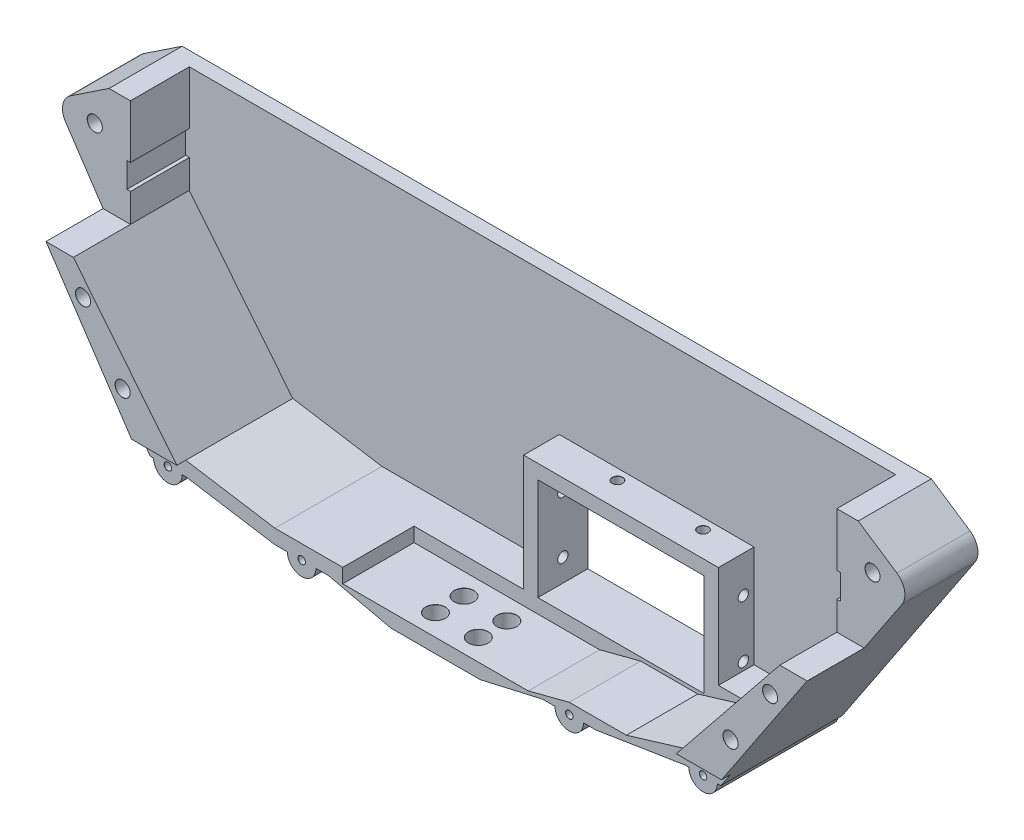
from build123d import *

# Parameters (mm, degrees)
EXTRUDE_1_DEPTH                  = 4
EXTRUDE_2_DEPTH                  = 16.5
SKETCH_4_W                       = 46.6
SKETCH_4_H                       = 28.6
CUT_EXTRUDE_1_DEPTH              = 4
EXTRUDE_3_DEPTH                  = 10
HOLE_WIZARD_M2_5_1_D             = 2.9
HOLE_WIZARD_M2_5_1_CSINK_D       = 2.95
HOLE_WIZARD_M2_5_1_CSINK_ANGLE   = 90
HOLE_WIZARD_M2_5_2_D             = 2.9
HOLE_WIZARD_M2_5_2_CSINK_D       = 2.95
HOLE_WIZARD_M2_5_2_CSINK_ANGLE   = 90
HOLE_WIZARD_M5_1_D               = 4.2
HOLE_WIZARD_M5_1_DEPTH           = 5
HOLE_WIZARD_M5_1_CSINK_D         = 4.25
HOLE_WIZARD_M5_1_CSINK_ANGLE     = 90
HOLE_WIZARD_M5_1_TIP             = 1.2618073
EXTRUDE_4_DEPTH                  = 17
EXTRUDE_START                    = -17
EXTRUDE_5_DEPTH                  = 34
EXTRUDE_6_DEPTH                  = 20
SKETCH_20_W                      = 52
SKETCH_20_H                      = 4
CUT_EXTRUDE_2_DEPTH              = 3
CUT_EXTRUDE_3_DEPTH              = 10
SKETCH_22_R                      = 4
EXTRUDE_7_DEPTH                  = 34
HOLE_WIZARD_M2_5_1_2_D           = 2.05
HOLE_WIZARD_M2_5_1_2_DEPTH       = 10
HOLE_WIZARD_M2_5_1_2_CSINK_D     = 2.1
HOLE_WIZARD_M2_5_1_2_CSINK_ANGLE = 90
HOLE_WIZARD_M2_5_1_2_TIP         = 0.615882135
CUT_EXTRUDE_4_DEPTH              = 20
EXTRUDE_8_DEPTH                  = 32.5
HOLE_WIZARD_M5_2_D               = 4.2
HOLE_WIZARD_M5_2_DEPTH           = 10
HOLE_WIZARD_M5_2_CSINK_D         = 4.25
HOLE_WIZARD_M5_2_CSINK_ANGLE     = 90
HOLE_WIZARD_M5_2_TIP             = 1.2618073
FILLET_1_R                       = 5
HOLE_WIZARD_M5_1_2_D             = 5.5
HOLE_WIZARD_M5_1_2_DEPTH         = 10
HOLE_WIZARD_M5_1_2_CSINK_D       = 5.55
HOLE_WIZARD_M5_1_2_CSINK_ANGLE   = 90
HOLE_WIZARD_M5_1_2_TIP           = 1.652366702


with BuildPart() as part:
    # 草图2 → 凸台-拉伸1 (new body)
    with BuildSketch(Plane.XY):
        Polygon((80, 0), (-80, 0), (-120, 60), (-105, 70), (105, 70), (120, 60), align=None)
    extrude(amount=EXTRUDE_1_DEPTH)

    # 草图3 → 凸台-拉伸2 (add)
    with BuildSketch(Plane.XY.offset(4)):
        Polygon((105, 70), (99, 70), (99, 55), (100, 55), (100, 48), (99, 48), (99, 40), (106.666666667, 40), (120, 60), align=None)
        Polygon((-120, 60), (-105, 70), (-99, 70), (-99, 55), (-100, 55), (-100, 48), (-99, 48), (-99, 40), (-106.666666667, 40), align=None)
    extrude(amount=EXTRUDE_2_DEPTH)

    # 草图4 → 切除-拉伸1 (cut)
    with BuildSketch(Plane.XY.offset(4)):
        with Locations((32, 14.3)):
            Rectangle(SKETCH_4_W, SKETCH_4_H)
    extrude(amount=-CUT_EXTRUDE_1_DEPTH, mode=Mode.SUBTRACT)

    # 草图5 → 凸台-拉伸3 (add)
    with BuildSketch(Plane.XY.offset(4)):
        Polygon((55.3, 28.6), (55.3, 0), (80, 0), (82.666666667, 4), (59.3, 4), (59.3, 32.6), (4.7, 32.6), (4.7, 4), (-82.666666667, 4), (-80, 0), (8.7, 0), (8.7, 28.6), align=None)
    extrude(amount=EXTRUDE_3_DEPTH)

    # Hole Wizard M2.5 _1 (through all)
    with Locations(Plane(origin=(0, 32.6, 0), x_dir=(1, 0, 0), z_dir=(0, 1, 0))):
        with Locations((24, -7), (48, -7)):
            CounterSinkHole(HOLE_WIZARD_M2_5_1_D / 2, HOLE_WIZARD_M2_5_1_CSINK_D / 2, counter_sink_angle=HOLE_WIZARD_M2_5_1_CSINK_ANGLE)

    # M2.5 间隙孔2 (through all)
    with Locations(Plane.ZY.offset(-4.7)):
        with Locations((7, 22.3), (7, 6.3)):
            CounterSinkHole(HOLE_WIZARD_M2_5_2_D / 2, HOLE_WIZARD_M2_5_2_CSINK_D / 2, counter_sink_angle=HOLE_WIZARD_M2_5_2_CSINK_ANGLE)

    # Hole Wizard M5 _1
    with Locations(Plane.XY.offset(20.5)):
        with Locations((-109, 59.5), (109, 59.5)):
            CounterSinkHole(HOLE_WIZARD_M5_1_D / 2, HOLE_WIZARD_M5_1_CSINK_D / 2, depth=HOLE_WIZARD_M5_1_DEPTH, counter_sink_angle=HOLE_WIZARD_M5_1_CSINK_ANGLE)
            with Locations((0, 0, -(HOLE_WIZARD_M5_1_DEPTH + HOLE_WIZARD_M5_1_TIP / 2))):  # 118° drill point
                Cone(0, HOLE_WIZARD_M5_1_D / 2, HOLE_WIZARD_M5_1_TIP, mode=Mode.SUBTRACT)

    # 草图16 → 凸台-拉伸4 (add)
    with BuildSketch(Plane(origin=(0, 0, 0), x_dir=(-1, 0, 0), z_dir=(0, 0, -1))):
        Polygon((-70, 0), (-45, -4), (45, -4), (70, 0), align=None)
    extrude(amount=-EXTRUDE_4_DEPTH)

    # 草图17 → 凸台-拉伸5 (add)
    with BuildSketch(Plane.XY.offset(17).offset(EXTRUDE_START)):
        Polygon((-30, -4), (-12.5, -8), (12.5, -8), (30, -4), align=None)
    extrude(amount=EXTRUDE_5_DEPTH)

    # 草图19 → 凸台-拉伸6 (add)
    with BuildSketch(Plane.XY.offset(14)):
        Polygon((-78.666666667, 4), (-82.666666667, 4), (-80, 0), (-70, 0), (-45, -4), (-26, -4), (-26, 0), (-45, 0), (-70, 4), align=None)
        Polygon((45, 0), (26, 0), (26, -4), (45, -4), (70, 0), (80, 0), (82.666666667, 4), (78.666666667, 4), (70, 4), align=None)
    extrude(amount=EXTRUDE_6_DEPTH)

    # 草图20 → 切除-拉伸2 (cut)
    with BuildSketch(Plane.XY.offset(17)):
        with Locations((0, -2)):
            Rectangle(SKETCH_20_W, SKETCH_20_H)
    extrude(amount=-CUT_EXTRUDE_2_DEPTH, mode=Mode.SUBTRACT)

    # 草图21 → 切除-拉伸3 (cut)
    with BuildSketch(Plane.XY.offset(14)):
        Polygon((4.7, 4), (4.7, 0), (-45, 0), (-70, 4), align=None)
    extrude(amount=-CUT_EXTRUDE_3_DEPTH, mode=Mode.SUBTRACT)

    # 草图22 → 凸台-拉伸7 (add)
    with BuildSketch(Plane.XY.offset(34)):
        with Locations((-75, 0)):
            Circle(SKETCH_22_R)
        with Locations((-37.5, -4)):
            Circle(SKETCH_22_R)
        with Locations((37.5, -4)):
            Circle(SKETCH_22_R)
        with Locations((75, 0)):
            Circle(SKETCH_22_R)
    extrude(amount=-EXTRUDE_7_DEPTH)

    # Hole Wizard M2.5 _1 2
    with Locations(Plane.XY.offset(34)):
        with Locations((-75, 0), (-37.5, -4), (37.5, -4), (75, 0)):
            CounterSinkHole(HOLE_WIZARD_M2_5_1_2_D / 2, HOLE_WIZARD_M2_5_1_2_CSINK_D / 2, depth=HOLE_WIZARD_M2_5_1_2_DEPTH, counter_sink_angle=HOLE_WIZARD_M2_5_1_2_CSINK_ANGLE)
            with Locations((0, 0, -(HOLE_WIZARD_M2_5_1_2_DEPTH + HOLE_WIZARD_M2_5_1_2_TIP / 2))):  # 118° drill point
                Cone(0, HOLE_WIZARD_M2_5_1_2_D / 2, HOLE_WIZARD_M2_5_1_2_TIP, mode=Mode.SUBTRACT)

    # 草图25 → 切除-拉伸4 (cut)
    with BuildSketch(Plane.XY.offset(34)):
        Polygon((26, 0), (26, -4), (37.515153504, -1), (53.499458489, -1), (70, 4), (45, 0), align=None)
    extrude(amount=-CUT_EXTRUDE_4_DEPTH, mode=Mode.SUBTRACT)

    # 草图26 → 凸台-拉伸8 (add)
    with BuildSketch(Plane.XY.offset(4)):
        Polygon((-99, 40), (-106.666666667, 40), (-82.666666667, 4), (-70, 4), align=None)
        Polygon((82.666666667, 4), (70, 4), (99, 40), (106.666666667, 40), align=None)
    extrude(amount=EXTRUDE_8_DEPTH)

    # M5 螺纹孔的螺纹孔钻头2
    with Locations(Plane.XY.offset(36.5)):
        with Locations((-96.286602224, 31.641005887), (-85.192598299, 15), (85.192598299, 15), (96.286602224, 31.641005887)):
            CounterSinkHole(HOLE_WIZARD_M5_2_D / 2, HOLE_WIZARD_M5_2_CSINK_D / 2, depth=HOLE_WIZARD_M5_2_DEPTH, counter_sink_angle=HOLE_WIZARD_M5_2_CSINK_ANGLE)
            with Locations((0, 0, -(HOLE_WIZARD_M5_2_DEPTH + HOLE_WIZARD_M5_2_TIP / 2))):  # 118° drill point
                Cone(0, HOLE_WIZARD_M5_2_D / 2, HOLE_WIZARD_M5_2_TIP, mode=Mode.SUBTRACT)

    # 圆角1
    fillet_1_edges = [part.edges().sort_by_distance(p)[0] for p in [
        (120, 60, 10.25),
        (-120, 60, 10.25),
    ]]
    fillet(fillet_1_edges, radius=FILLET_1_R)

    # Hole Wizard M5 _1 2
    with Locations(Plane(origin=(0, -4, 0), x_dir=(1, 0, 0), z_dir=(0, 1, 0))):
        with Locations((-6, -20), (6, -20), (6, -28), (-6, -28)):
            CounterSinkHole(HOLE_WIZARD_M5_1_2_D / 2, HOLE_WIZARD_M5_1_2_CSINK_D / 2, depth=HOLE_WIZARD_M5_1_2_DEPTH, counter_sink_angle=HOLE_WIZARD_M5_1_2_CSINK_ANGLE)
            with Locations((0, 0, -(HOLE_WIZARD_M5_1_2_DEPTH + HOLE_WIZARD_M5_1_2_TIP / 2))):  # 118° drill point
                Cone(0, HOLE_WIZARD_M5_1_2_D / 2, HOLE_WIZARD_M5_1_2_TIP, mode=Mode.SUBTRACT)


solid = part.part
